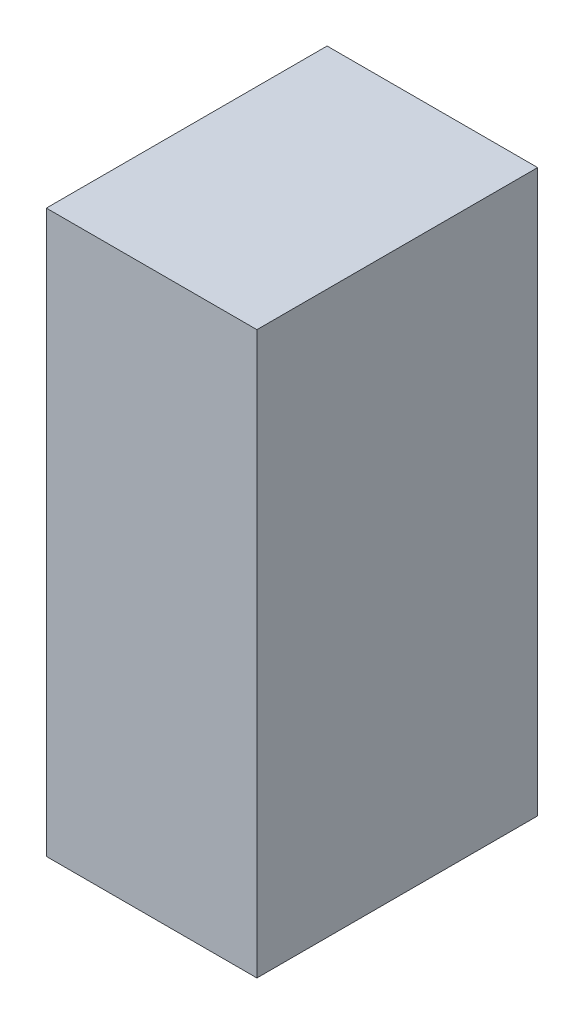
from build123d import *

# Parameters (mm, degrees)
SKETCH_1_W      = 1.5
SKETCH_1_H      = 2
EXTRUDE_1_DEPTH = 4


with BuildPart() as part:
    # 草图1 → 凸台-拉伸1 (new body)
    with BuildSketch(Plane(origin=(0, 0, 0), x_dir=(1, 0, 0), z_dir=(0, 1, 0))):
        with Locations((0.75, -1)):
            Rectangle(SKETCH_1_W, SKETCH_1_H)
    extrude(amount=EXTRUDE_1_DEPTH)


solid = part.part
